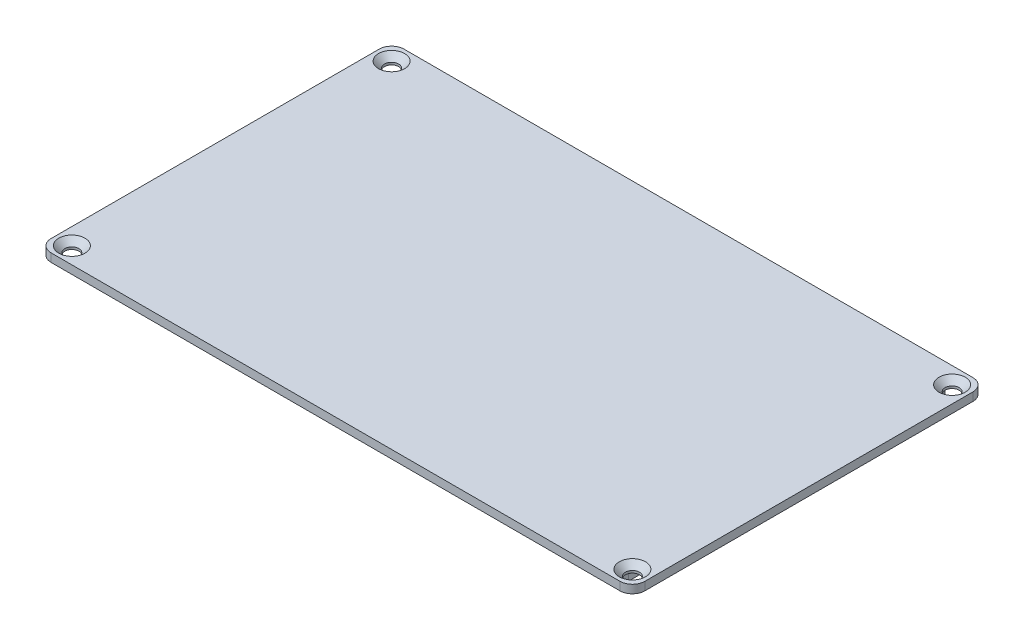
from build123d import *

# Parameters (mm, degrees)
SKIZZE1_W                                            = 131
SKIZZE1_H                                            = 81
SKIZZE1_W_2                                          = 127
SKIZZE1_H_2                                          = 77
AUFSATZ_LINEAR_AUSTRAGEN1_DEPTH                      = 2
SKIZZE2_W                                            = 143
SKIZZE2_H                                            = 85
AUFSATZ_LINEAR_AUSTRAGEN2_DEPTH                      = 2
VERRUNDUNG1_R                                        = 3
FORMSENKUNG_F_R_M3_LINSENSENKSCHRAUBE_MI_D           = 3.4
FORMSENKUNG_F_R_M3_LINSENSENKSCHRAUBE_MI_DEPTH       = 7.25
FORMSENKUNG_F_R_M3_LINSENSENKSCHRAUBE_MI_CSINK_D     = 6.3
FORMSENKUNG_F_R_M3_LINSENSENKSCHRAUBE_MI_CSINK_ANGLE = 90
FORMSENKUNG_F_R_M3_LINSENSENKSCHRAUBE_MI_TIP         = 1.021463052


with BuildPart() as part:
    # Skizze1 → Aufsatz-Linear austragen1 (new body)
    with BuildSketch(Plane(origin=(0, 0, 0), x_dir=(1, 0, 0), z_dir=(0, 1, 0))):
        with Locations((65.5, 40.5)):
            Rectangle(SKIZZE1_W, SKIZZE1_H)
        with Locations((65.5, 40.5)):
            Rectangle(SKIZZE1_W_2, SKIZZE1_H_2, mode=Mode.SUBTRACT)
    extrude(amount=AUFSATZ_LINEAR_AUSTRAGEN1_DEPTH)

    # Skizze2 → Aufsatz-Linear austragen2 (add)
    with BuildSketch(Plane(origin=(0, 2, 0), x_dir=(1, 0, 0), z_dir=(0, 1, 0))):
        with Locations((65.5, 40.5)):
            Rectangle(SKIZZE2_W, SKIZZE2_H)
    extrude(amount=AUFSATZ_LINEAR_AUSTRAGEN2_DEPTH)

    # Verrundung1
    verrundung1_edges = [part.edges().sort_by_distance(p)[0] for p in [
        (-6, 3, -83),
        (-6, 3, 2),
        (137, 3, 2),
        (137, 3, -83),
        (0, 1, -81),
        (131, 1, -81),
        (131, 1, 0),
        (0, 1, 0),
    ]]
    fillet(verrundung1_edges, radius=VERRUNDUNG1_R)

    # Formsenkung für M3 Linsensenkschraube mit Schlitz1
    with Locations(Plane(origin=(0, 4, 0), x_dir=(1, 0, 0), z_dir=(0, 1, 0))):
        with Locations((-2, 2), (133, 79), (-2, 79), (133, 2)):
            CounterSinkHole(FORMSENKUNG_F_R_M3_LINSENSENKSCHRAUBE_MI_D / 2, FORMSENKUNG_F_R_M3_LINSENSENKSCHRAUBE_MI_CSINK_D / 2, depth=FORMSENKUNG_F_R_M3_LINSENSENKSCHRAUBE_MI_DEPTH, counter_sink_angle=FORMSENKUNG_F_R_M3_LINSENSENKSCHRAUBE_MI_CSINK_ANGLE)
            with Locations((0, 0, -(FORMSENKUNG_F_R_M3_LINSENSENKSCHRAUBE_MI_DEPTH + FORMSENKUNG_F_R_M3_LINSENSENKSCHRAUBE_MI_TIP / 2))):  # 118° drill point
                Cone(0, FORMSENKUNG_F_R_M3_LINSENSENKSCHRAUBE_MI_D / 2, FORMSENKUNG_F_R_M3_LINSENSENKSCHRAUBE_MI_TIP, mode=Mode.SUBTRACT)


solid = part.part
